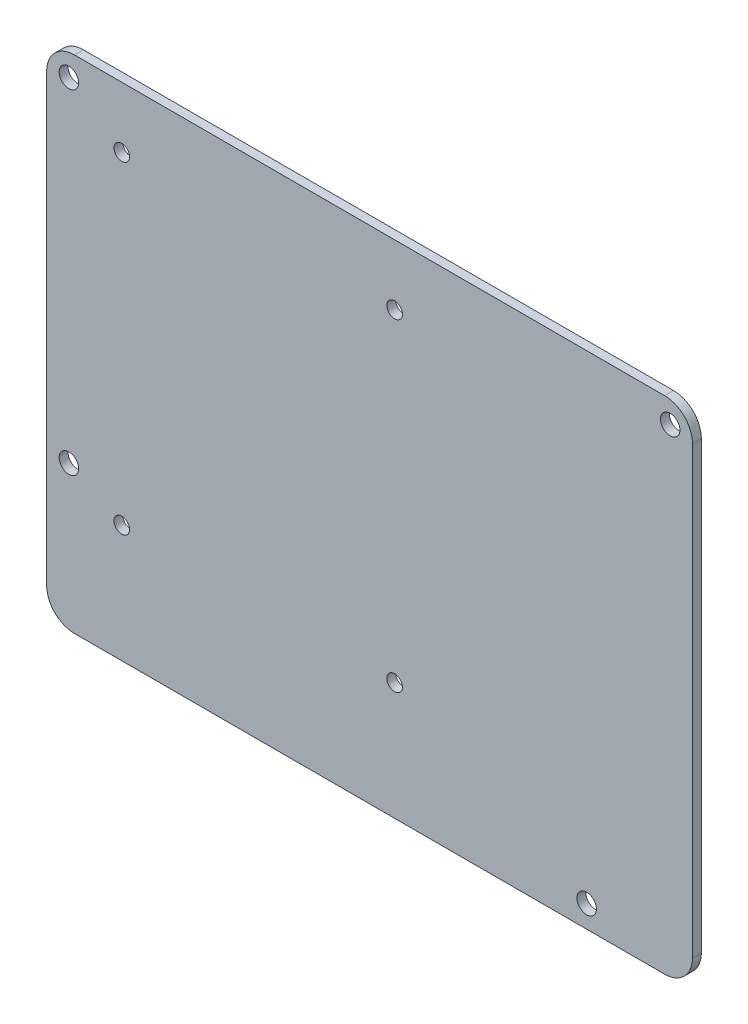
from build123d import *

# Parameters (mm, degrees)
SKETCH1_W                  = 116
SKETCH1_H                  = 90
BOSS_EXTRUDE1_DEPTH        = 1.6
F_3_5_3_5_DIAMETER_HOLE1_D = 3.5
FILLET1_R                  = 5
F_2_8_2_8_DIAMETER_HOLE1_D = 2.8


with BuildPart() as part:
    # Sketch1 → Boss-Extrude1 (new body)
    with BuildSketch(Plane.XY):
        with Locations((-39, 41)):
            Rectangle(SKETCH1_W, SKETCH1_H)
    extrude(amount=BOSS_EXTRUDE1_DEPTH)

    # Ø3.5 (3.5) Diameter Hole1 (through all)
    with Locations(Plane.XY.offset(1.6)):
        with Locations((0, 0), (15, 82), (-93, 82), (-93, 22)):
            Hole(F_3_5_3_5_DIAMETER_HOLE1_D / 2)

    # Fillet1
    fillet1_edges = [part.edges().sort_by_distance(p)[0] for p in [
        (-97, 86, 0.8),
        (19, 86, 0.8),
        (19, -4, 0.8),
        (-97, -4, 0.8),
    ]]
    fillet(fillet1_edges, radius=FILLET1_R)

    # Ø2.8 (2.8) Diameter Hole1 (through all)
    with Locations(Plane(origin=(0, 0, 0), x_dir=(-1, 0, 0), z_dir=(0, 0, -1))):
        with Locations((34.5, 75.1), (83.5, 75.1), (83.5, 17.1), (34.5, 17.1)):
            Hole(F_2_8_2_8_DIAMETER_HOLE1_D / 2)


solid = part.part
